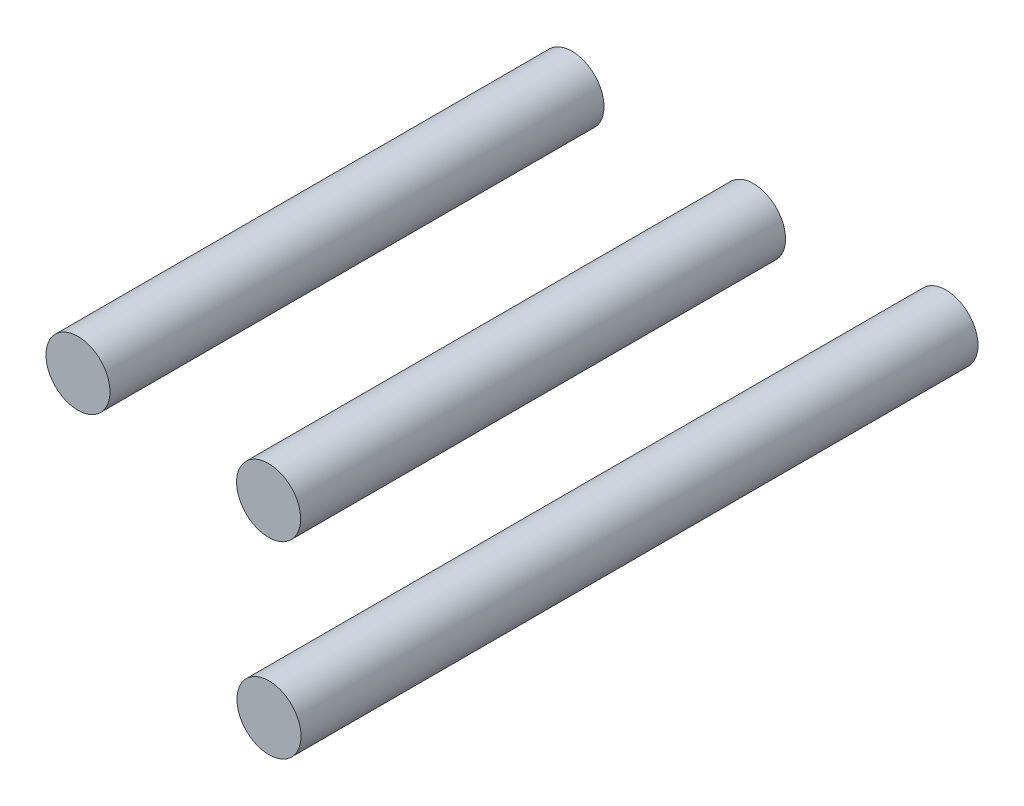
from build123d import *

# Parameters (mm, degrees)
SKETCH1_R           = 3.5
BOSS_EXTRUDE1_DEPTH = 54
SKETCH2_R           = 3.5
BOSS_EXTRUDE2_DEPTH = 53
SKETCH3_R           = 3.5
BOSS_EXTRUDE3_DEPTH = 74


with BuildPart() as part:
    # Sketch1 → Boss-Extrude1 (new body)
    with BuildSketch(Plane.XY):
        with Locations((-61.152195741, -5.292016939)):
            Circle(SKETCH1_R)
    extrude(amount=BOSS_EXTRUDE1_DEPTH)


with BuildPart() as body_2:
    # Sketch2 → Boss-Extrude2 (new body)
    with BuildSketch(Plane.XY):
        with Locations((-41.315116744, -7.905454397)):
            Circle(SKETCH2_R)
    extrude(amount=BOSS_EXTRUDE2_DEPTH)


with BuildPart() as body_3:
    # Sketch3 → Boss-Extrude3 (new body)
    with BuildSketch(Plane.XY):
        with Locations((-20.273710763, -7.457605747)):
            Circle(SKETCH3_R)
    extrude(amount=BOSS_EXTRUDE3_DEPTH)


solid = Compound([part.part, body_2.part, body_3.part])
